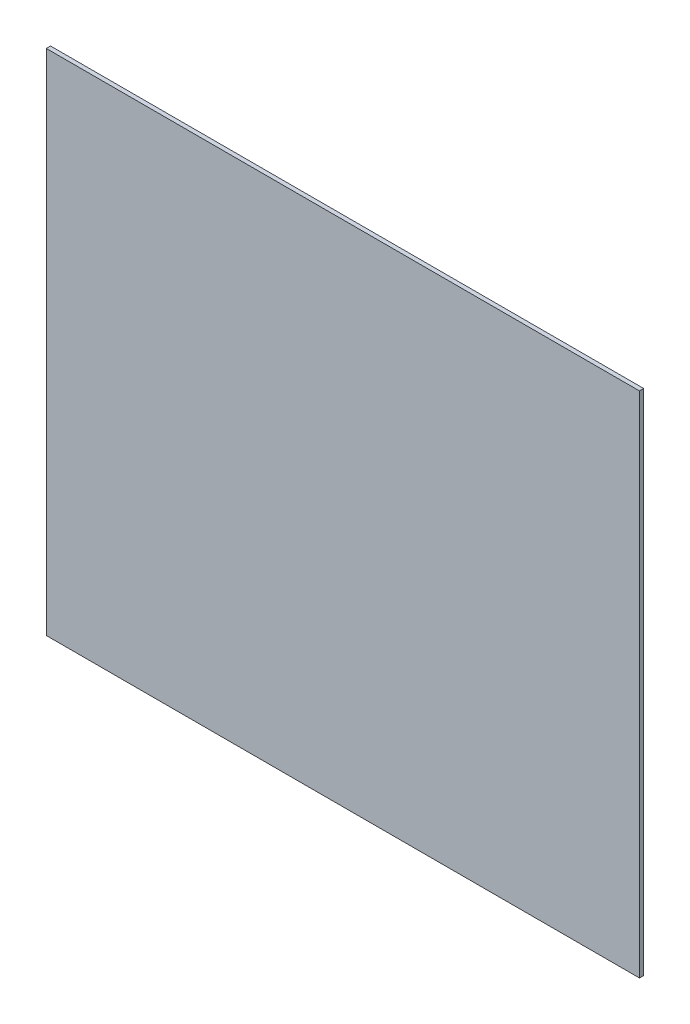
from build123d import *

# Parameters (mm, degrees)
SKETCH1_W           = 280
SKETCH1_H           = 240
BOSS_EXTRUDE1_DEPTH = 2


with BuildPart() as part:
    # Sketch1 → Boss-Extrude1 (new body)
    with BuildSketch(Plane.XY):
        Rectangle(SKETCH1_W, SKETCH1_H)
    extrude(amount=BOSS_EXTRUDE1_DEPTH)


solid = part.part
